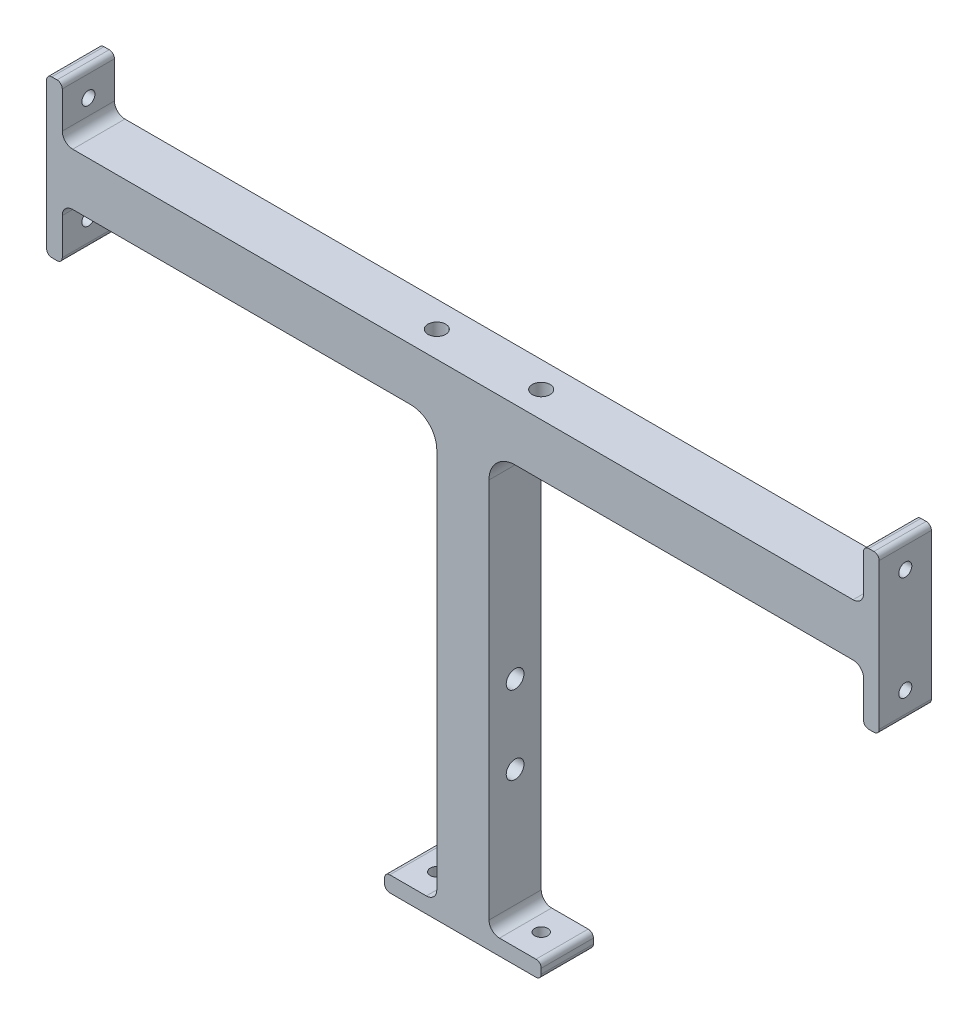
from build123d import *

# Parameters (mm, degrees)
BOSS_EXTRUDE1_DEPTH      = 12.7
SKETCH2_R                = 1.5875
SIDE_MOUNT_HOLES_DEPTH   = 6.35
SKETCH3_R                = 1.5875
BOTTOM_MOUNT_HOLES_DEPTH = 3.81
FILLET1_R                = 6.35
FILLET2_R                = 2.54
SKETCH4_R                = 2.159
SWITCH_MOUNT_HOLES_DEPTH = 7.112
SKETCH5_R                = 2.159
CUT_EXTRUDE1_DEPTH       = 7.112
FILLET3_R                = 1.27


with BuildPart() as part:
    # Sketch1 → Boss-Extrude1 (new body)
    with BuildSketch(Plane.XY):
        Polygon((19.05, 0), (-19.05, 0), (-19.05, 3.81), (-6.35, 3.81), (-6.35, 105.41), (-97.4598, 105.41), (-97.4598, 92.71), (-101.2698, 92.71), (-101.2698, 130.81), (-97.4598, 130.81), (-97.4598, 118.11), (97.4598, 118.11), (97.4598, 130.81), (101.2698, 130.81), (101.2698, 92.71), (97.4598, 92.71), (97.4598, 105.41), (6.35, 105.41), (6.35, 3.81), (19.05, 3.81), align=None)
    extrude(amount=BOSS_EXTRUDE1_DEPTH)

    # Sketch2 → Side-Mount-Holes (cut)
    with BuildSketch(Plane(origin=(101.2698, 0, 0), x_dir=(0, 0, -1), z_dir=(1, 0, 0))):
        with Locations(Location((-6.35, 124.46, 0), (0, 0, 90))):
            Circle(SKETCH2_R)
        with Locations(Location((-6.35, 99.06, 0), (0, 0, 90))):
            Circle(SKETCH2_R)
    side_mount_holes = extrude(amount=-SIDE_MOUNT_HOLES_DEPTH, mode=Mode.SUBTRACT)

    # Mirror1: Side-Mount-Holes across plane
    add(side_mount_holes.mirror(Plane(origin=(0, 0, 0), x_dir=(0, 0, 1), z_dir=(1, 0, 0))), mode=Mode.SUBTRACT)

    # Sketch3 → Bottom_Mount_Holes (cut)
    with BuildSketch(Plane.XZ):
        with Locations((12.7, 6.35)):
            Circle(SKETCH3_R)
        with Locations(Location((-12.7, 6.35, 0), (0, 0, 270))):
            Circle(SKETCH3_R)
    extrude(amount=-BOTTOM_MOUNT_HOLES_DEPTH, mode=Mode.SUBTRACT)

    # Fillet1
    fillet1_edges = [part.edges().sort_by_distance(p)[0] for p in [
        (-6.35, 105.41, 6.35),
        (6.35, 105.41, 6.35),
    ]]
    fillet(fillet1_edges, radius=FILLET1_R)

    # Fillet2
    fillet2_edges = [part.edges().sort_by_distance(p)[0] for p in [
        (-6.35, 3.81, 6.35),
        (-97.4598, 105.41, 6.35),
        (-97.4598, 118.11, 6.35),
        (97.4598, 118.11, 6.35),
        (97.4598, 105.41, 6.35),
        (6.35, 3.81, 6.35),
    ]]
    fillet(fillet2_edges, radius=FILLET2_R)

    # Sketch4 → Switch_Mount_Holes (cut)
    with BuildSketch(Plane(origin=(6.35, 0, 0), x_dir=(0, 0, -1), z_dir=(1, 0, 0))):
        with Locations(Location((-6.35, 53.975, 0), (0, 0, 90))):
            Circle(SKETCH4_R)
        with Locations(Location((-6.35, 34.925, 0), (0, 0, 270))):
            Circle(SKETCH4_R)
    extrude(amount=-SWITCH_MOUNT_HOLES_DEPTH, mode=Mode.SUBTRACT)

    # Sketch5 → Cut-Extrude1 (cut)
    with BuildSketch(Plane(origin=(0, 118.11, 0), x_dir=(1, 0, 0), z_dir=(0, 1, 0))):
        with Locations(Location((-12.7, -6.35, 0), (0, 0, 180))):
            Circle(SKETCH5_R)
        with Locations((12.7, -6.35)):
            Circle(SKETCH5_R)
    extrude(amount=-CUT_EXTRUDE1_DEPTH, mode=Mode.SUBTRACT)

    # Fillet3
    fillet3_edges = [part.edges().sort_by_distance(p)[0] for p in [
        (-19.05, 3.81, 6.35),
        (-97.4598, 92.71, 6.35),
        (-101.2698, 92.71, 6.35),
        (-101.2698, 130.81, 6.35),
        (-97.4598, 130.81, 6.35),
        (97.4598, 130.81, 6.35),
        (101.2698, 130.81, 6.35),
        (101.2698, 92.71, 6.35),
        (97.4598, 92.71, 6.35),
        (19.05, 3.81, 6.35),
        (19.05, 0, 6.35),
        (-19.05, 0, 6.35),
    ]]
    fillet(fillet3_edges, radius=FILLET3_R)


solid = part.part
